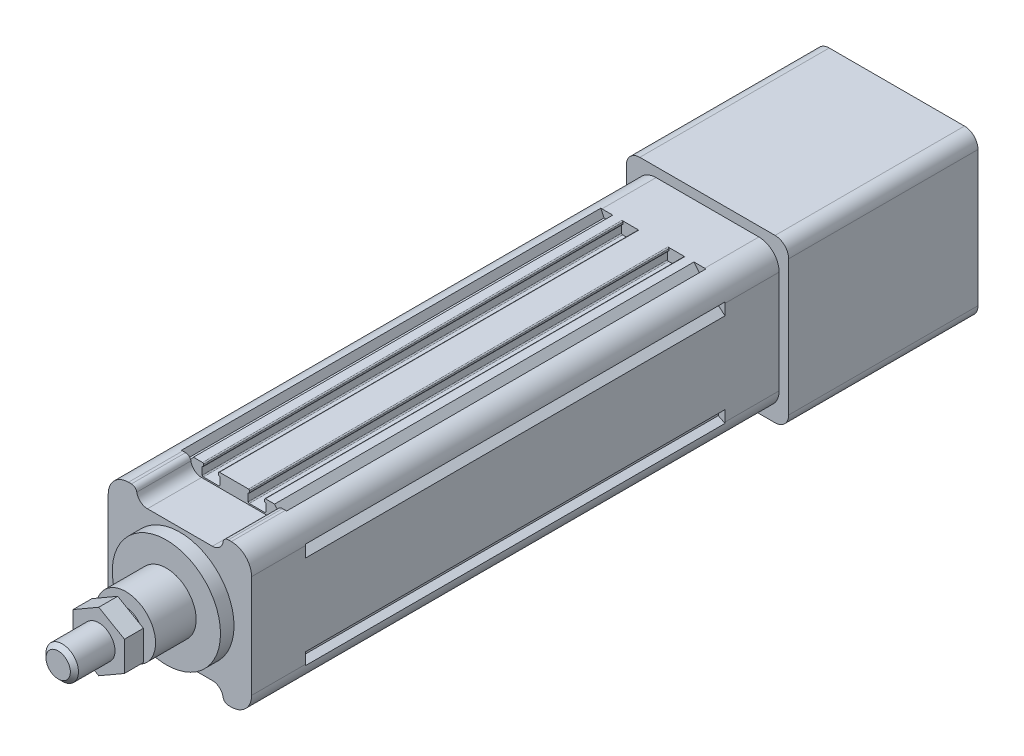
from build123d import *

# Parameters (mm, degrees)
SKETCH_1_R             = 2.1
EXTRUDE_1_DEPTH        = 155
EXTRUDE_2_DEPTH        = 20
SKETCH_7_R             = 20
EXTRUDE_3_DEPTH        = 5
SKETCH_9_R             = 11
EXTRUDE_4_DEPTH        = 15
SKETCH_10_R            = 6
EXTRUDE_5_DEPTH        = 25
EXTRUDE_START          = 20
EXTRUDE_6_DEPTH        = 20
EXTRUDE_7_DEPTH        = 70
SKETCH_14_R            = 19
CUT_EXTRUDE_2_DEPTH    = 70
HOLE_WIZARD_M6_1_D     = 5
HOLE_WIZARD_M6_1_DEPTH = 15
HOLE_WIZARD_M6_1_TIP   = 1.502151548
CHAMFER_1_SIZE         = 1.5
EXTRUDE_START_2        = 3
EXTRUDE_8_DEPTH        = 7


with BuildPart() as part:
    # 草图1 → 凸台-拉伸1 (new body)
    with BuildSketch(Plane.XY):
        with BuildLine():
            Line((-18.2, 24), (-19.443439638, 26.486879276))
            ThreePointArc((-19.443439638, 26.486879276), (-24.303300859, 24.303300859), (-26.486879276, 19.443439638))
            Line((-26.486879276, 19.443439638), (-24, 18.2))
            Line((-24, 18.2), (-24, 17.1))
            Line((-24, 17.1), (-26.5, 15))
            Line((-26.5, 15), (-26.5, -15))
            Line((-26.5, -15), (-24, -17.1))
            Line((-24, -17.1), (-24, -18.2))
            Line((-24, -18.2), (-26.486879276, -19.443439638))
            ThreePointArc((-26.486879276, -19.443439638), (-24.303300859, -24.303300859), (-19.443439638, -26.486879276))
            Line((-19.443439638, -26.486879276), (-18.2, -24))
            Line((-18.2, -24), (-17.1, -24))
            Line((-17.1, -24), (-15, -26.5))
            Line((-15, -26.5), (-11.65, -26.5))
            ThreePointArc((-11.65, -26.5), (-11.367157288, -26.382842712), (-11.25, -26.1))
            Line((-11.25, -26.1), (-11.25, -25.6))
            ThreePointArc((-11.25, -25.6), (-11.367157288, -25.317157288), (-11.65, -25.2))
            Line((-11.65, -25.2), (-11.75, -25.2))
            Line((-11.75, -25.2), (-11.75, -22.4))
            ThreePointArc((-11.75, -22.4), (-11.632842712, -22.117157288), (-11.35, -22))
            Line((-11.35, -22), (-5.65, -22))
            ThreePointArc((-5.65, -22), (-5.367157288, -22.117157288), (-5.25, -22.4))
            Line((-5.25, -22.4), (-5.25, -25.2))
            Line((-5.25, -25.2), (-5.35, -25.2))
            ThreePointArc((-5.35, -25.2), (-5.632842712, -25.317157288), (-5.75, -25.6))
            Line((-5.75, -25.6), (-5.75, -26.1))
            ThreePointArc((-5.75, -26.1), (-5.632842712, -26.382842712), (-5.35, -26.5))
            Line((-5.35, -26.5), (5.35, -26.5))
            ThreePointArc((5.35, -26.5), (5.632842712, -26.382842712), (5.75, -26.1))
            Line((5.75, -26.1), (5.75, -25.6))
            ThreePointArc((5.75, -25.6), (5.632842712, -25.317157288), (5.35, -25.2))
            Line((5.35, -25.2), (5.25, -25.2))
            Line((5.25, -25.2), (5.25, -22.4))
            ThreePointArc((5.25, -22.4), (5.367157288, -22.117157288), (5.65, -22))
            Line((5.65, -22), (11.35, -22))
            ThreePointArc((11.35, -22), (11.632842712, -22.117157288), (11.75, -22.4))
            Line((11.75, -22.4), (11.75, -25.2))
            Line((11.75, -25.2), (11.65, -25.2))
            ThreePointArc((11.65, -25.2), (11.367157288, -25.317157288), (11.25, -25.6))
            Line((11.25, -25.6), (11.25, -26.1))
            ThreePointArc((11.25, -26.1), (11.367157288, -26.382842712), (11.65, -26.5))
            Line((11.65, -26.5), (15, -26.5))
            Line((15, -26.5), (17.1, -24))
            Line((17.1, -24), (18.2, -24))
            Line((18.2, -24), (19.443439638, -26.486879276))
            ThreePointArc((19.443439638, -26.486879276), (24.303300859, -24.303300859), (26.486879276, -19.443439638))
            Line((26.486879276, -19.443439638), (24, -18.2))
            Line((24, -18.2), (24, -17.1))
            Line((24, -17.1), (26.5, -15))
            Line((26.5, -15), (26.5, 15))
            Line((26.5, 15), (24, 17.1))
            Line((24, 17.1), (24, 18.2))
            Line((24, 18.2), (26.486879276, 19.443439638))
            ThreePointArc((26.486879276, 19.443439638), (24.303300859, 24.303300859), (19.443439638, 26.486879276))
            Line((19.443439638, 26.486879276), (18.2, 24))
            Line((18.2, 24), (17.1, 24))
            Line((17.1, 24), (15, 26.5))
            Line((15, 26.5), (11.65, 26.5))
            ThreePointArc((11.65, 26.5), (11.367157288, 26.382842712), (11.25, 26.1))
            Line((11.25, 26.1), (11.25, 25.6))
            ThreePointArc((11.25, 25.6), (11.367157288, 25.317157288), (11.65, 25.2))
            Line((11.65, 25.2), (11.75, 25.2))
            Line((11.75, 25.2), (11.75, 22.4))
            ThreePointArc((11.75, 22.4), (11.632842712, 22.117157288), (11.35, 22))
            Line((11.35, 22), (5.65, 22))
            ThreePointArc((5.65, 22), (5.367157288, 22.117157288), (5.25, 22.4))
            Line((5.25, 22.4), (5.25, 25.2))
            Line((5.25, 25.2), (5.35, 25.2))
            ThreePointArc((5.35, 25.2), (5.632842712, 25.317157288), (5.75, 25.6))
            Line((5.75, 25.6), (5.75, 26.1))
            ThreePointArc((5.75, 26.1), (5.632842712, 26.382842712), (5.35, 26.5))
            Line((5.35, 26.5), (-5.35, 26.5))
            ThreePointArc((-5.35, 26.5), (-5.632842712, 26.382842712), (-5.75, 26.1))
            Line((-5.75, 26.1), (-5.75, 25.6))
            ThreePointArc((-5.75, 25.6), (-5.632842712, 25.317157288), (-5.35, 25.2))
            Line((-5.35, 25.2), (-5.25, 25.2))
            Line((-5.25, 25.2), (-5.25, 22.4))
            ThreePointArc((-5.25, 22.4), (-5.367157288, 22.117157288), (-5.65, 22))
            Line((-5.65, 22), (-11.35, 22))
            ThreePointArc((-11.35, 22), (-11.632842712, 22.117157288), (-11.75, 22.4))
            Line((-11.75, 22.4), (-11.75, 25.2))
            Line((-11.75, 25.2), (-11.65, 25.2))
            ThreePointArc((-11.65, 25.2), (-11.367157288, 25.317157288), (-11.25, 25.6))
            Line((-11.25, 25.6), (-11.25, 26.1))
            ThreePointArc((-11.25, 26.1), (-11.367157288, 26.382842712), (-11.65, 26.5))
            Line((-11.65, 26.5), (-15, 26.5))
            Line((-15, 26.5), (-17.1, 24))
            Line((-17.1, 24), (-18.2, 24))
        make_face()
        with Locations((19, 19)):
            Circle(SKETCH_1_R, mode=Mode.SUBTRACT)
        with Locations((19, -19)):
            Circle(SKETCH_1_R, mode=Mode.SUBTRACT)
        with Locations((-19, -19)):
            Circle(SKETCH_1_R, mode=Mode.SUBTRACT)
        with Locations((-19, 19)):
            Circle(SKETCH_1_R, mode=Mode.SUBTRACT)
        with BuildLine():
            Line((19.773719933, 3), (23.3, 3))
            Line((23.3, 3), (23.3, -3))
            Line((23.3, -3), (19.773719933, -3))
            ThreePointArc((19.773719933, -3), (0, -20), (-19.773719933, -3))
            Line((-19.773719933, -3), (-23.3, -3))
            Line((-23.3, -3), (-23.3, 3))
            Line((-23.3, 3), (-19.773719933, 3))
            ThreePointArc((-19.773719933, 3), (0, 20), (19.773719933, 3))
        make_face(mode=Mode.SUBTRACT)
    extrude(amount=EXTRUDE_1_DEPTH)

    # 草图6 → 凸台-拉伸2 (add)
    with BuildSketch(Plane.XY.offset(155)):
        with BuildLine():
            Line((-26.5, -19), (-26.5, 19))
            ThreePointArc((-26.5, 19), (-24.303300859, 24.303300859), (-19, 26.5))
            Line((-19, 26.5), (-17.916079783, 26.5))
            ThreePointArc((-17.916079783, 26.5), (-16.625085334, 26.027525232), (-15.944053189, 24.833333333))
            ThreePointArc((-15.944053189, 24.833333333), (-14.581988897, 22.444949537), (-12, 21.5))
            Line((-12, 21.5), (12, 21.5))
            ThreePointArc((12, 21.5), (14.581988897, 22.444949537), (15.944053189, 24.833333333))
            ThreePointArc((15.944053189, 24.833333333), (16.625085334, 26.027525232), (17.916079783, 26.5))
            Line((17.916079783, 26.5), (19, 26.5))
            ThreePointArc((19, 26.5), (24.303300859, 24.303300859), (26.5, 19))
            Line((26.5, 19), (26.5, -19))
            ThreePointArc((26.5, -19), (24.303300859, -24.303300859), (19, -26.5))
            Line((19, -26.5), (17.916079783, -26.5))
            ThreePointArc((17.916079783, -26.5), (16.625085334, -26.027525232), (15.944053189, -24.833333333))
            ThreePointArc((15.944053189, -24.833333333), (14.581988897, -22.444949537), (12, -21.5))
            Line((12, -21.5), (-12, -21.5))
            ThreePointArc((-12, -21.5), (-14.581988897, -22.444949537), (-15.944053189, -24.833333333))
            ThreePointArc((-15.944053189, -24.833333333), (-16.625085334, -26.027525232), (-17.916079783, -26.5))
            Line((-17.916079783, -26.5), (-19, -26.5))
            ThreePointArc((-19, -26.5), (-24.303300859, -24.303300859), (-26.5, -19))
        make_face()
    extrude(amount=EXTRUDE_2_DEPTH)

    # 草图7 → 凸台-拉伸3 (add)
    with BuildSketch(Plane.XY.offset(175)):
        Circle(SKETCH_7_R)
    extrude(amount=EXTRUDE_3_DEPTH)

    # 草图9 → 凸台-拉伸4 (add)
    with BuildSketch(Plane.XY.offset(180)):
        Circle(SKETCH_9_R)
    extrude(amount=EXTRUDE_4_DEPTH)

    # 草图10 → 凸台-拉伸5 (add)
    with BuildSketch(Plane.XY.offset(195)):
        Circle(SKETCH_10_R)
    extrude(amount=EXTRUDE_5_DEPTH)

    # 草图11 → 凸台-拉伸6 (add)
    with BuildSketch(Plane(origin=(0, 0, 0), x_dir=(-1, 0, 0), z_dir=(0, 0, -1)).offset(EXTRUDE_START)):
        with BuildLine():
            Line((-19, -26.5), (19, -26.5))
            ThreePointArc((19, -26.5), (24.303300859, -24.303300859), (26.5, -19))
            Line((26.5, -19), (26.5, 19))
            ThreePointArc((26.5, 19), (24.303300859, 24.303300859), (19, 26.5))
            Line((19, 26.5), (-19, 26.5))
            ThreePointArc((-19, 26.5), (-24.303300859, 24.303300859), (-26.5, 19))
            Line((-26.5, 19), (-26.5, -19))
            ThreePointArc((-26.5, -19), (-24.303300859, -24.303300859), (-19, -26.5))
        make_face()
    extrude(amount=-EXTRUDE_6_DEPTH)

    # 草图12 → 凸台-拉伸7 (add)
    with BuildSketch(Plane(origin=(0, 0, -20), x_dir=(-1, 0, 0), z_dir=(0, 0, -1))):
        with BuildLine():
            Line((-25, -30), (25, -30))
            ThreePointArc((25, -30), (28.535533906, -28.535533906), (30, -25))
            Line((30, -25), (30, 25))
            ThreePointArc((30, 25), (28.535533906, 28.535533906), (25, 30))
            Line((25, 30), (-25, 30))
            ThreePointArc((-25, 30), (-28.535533906, 28.535533906), (-30, 25))
            Line((-30, 25), (-30, -25))
            ThreePointArc((-30, -25), (-28.535533906, -28.535533906), (-25, -30))
        make_face()
    extrude(amount=EXTRUDE_7_DEPTH)

    # 草图14 → 切除-拉伸2 (cut)
    with BuildSketch(Plane(origin=(0, 0, -90), x_dir=(-1, 0, 0), z_dir=(0, 0, -1))):
        Circle(SKETCH_14_R)
    extrude(amount=-CUT_EXTRUDE_2_DEPTH, mode=Mode.SUBTRACT)

    # M6 螺纹孔1
    with Locations(Plane.ZY.offset(26.5)):
        with Locations((165, 11), (165, -11), (-10, 11), (-10, -11)):
            Hole(HOLE_WIZARD_M6_1_D / 2, depth=HOLE_WIZARD_M6_1_DEPTH)
            with Locations((0, 0, -(HOLE_WIZARD_M6_1_DEPTH + HOLE_WIZARD_M6_1_TIP / 2))):  # 118° drill point
                Cone(0, HOLE_WIZARD_M6_1_D / 2, HOLE_WIZARD_M6_1_TIP, mode=Mode.SUBTRACT)

    # 倒角1
    chamfer_1_edges = [part.edges().sort_by_distance(p)[0] for p in [
        (-6, 0, 220),
    ]]
    chamfer(chamfer_1_edges, length=CHAMFER_1_SIZE)

    # 草图17 → 凸台-拉伸8 (add)
    with BuildSketch(Plane.XY.offset(195).offset(EXTRUDE_START_2)):
        Polygon((0, 10.969655115), (-9.5, 5.484827557), (-9.5, -5.484827557), (0, -10.969655115), (9.5, -5.484827557), (9.5, 5.484827557), align=None)
    extrude(amount=EXTRUDE_8_DEPTH)


solid = part.part
